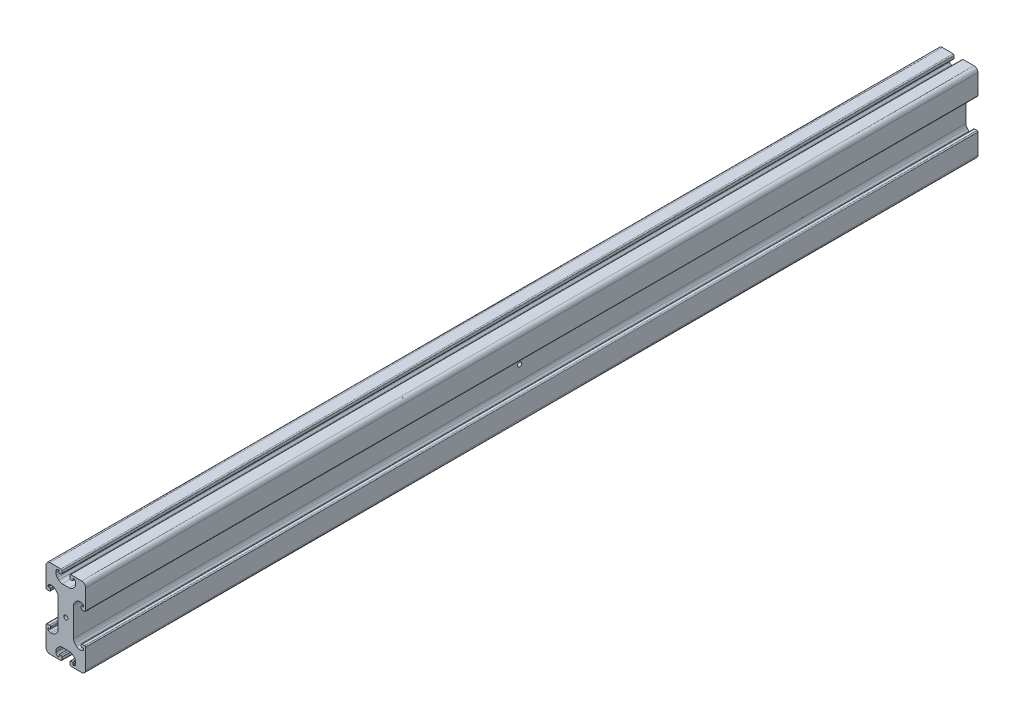
from build123d import *

# Parameters (mm, degrees)
EXTRUDE_3_DEPTH    = 900
HOLE_WIZARD_M5_1_D = 4.2
HOLE_WIZARD_M5_2_D = 4.2


with BuildPart() as part:
    # Model → 凸台-拉伸3 (new body)
    with BuildSketch(Plane.XY):
        with BuildLine():
            Line((3046.183678534, 1527.304832729), (3046.183678534, 1529.804889962))
            add(Edge.make_bspline(
                [(3046.183678534, 1529.804889962), (3046.183678534, 1530.108777492), (3046.477620245, 1530.598884032), (3046.929836169, 1530.80481748), (3047.183606011, 1530.80481748)],
                knots=[0, 0, 0, 0, 0.565195279, 1, 1, 1, 1], degree=3))
            Line((3047.183606011, 1530.80481748), (3048.683735721, 1530.80481748))
            add(Edge.make_bspline(
                [(3048.683735721, 1530.80481748), (3048.814583007, 1530.80481748), (3049.063948712, 1530.68728955), (3049.183699488, 1530.463207638), (3049.183699488, 1530.304853729)],
                knots=[0, 0, 0, 0, 0.482405948, 1, 1, 1, 1], degree=3))
            Line((3049.183699488, 1530.304853729), (3049.183699488, 1528.754894547))
            add(Edge.make_bspline(
                [(3049.183699488, 1528.754894547), (3049.183699488, 1528.621135634), (3049.310613574, 1528.399867559), (3049.514098722, 1528.304760288), (3049.633595356, 1528.304760288)],
                knots=[0, 0, 0, 0, 0.549542039, 1, 1, 1, 1], degree=3))
            Line((3049.633595356, 1528.304760288), (3049.683663262, 1528.304760288))
            add(Edge.make_bspline(
                [(3049.683663262, 1528.304760288), (3050.380891253, 1528.304760288), (3051.623803853, 1528.908542343), (3052.183720448, 1530.04566751), (3052.183720448, 1530.804817427)],
                knots=[0, 0, 0, 0, 0.502793736, 1, 1, 1, 1], degree=3))
            Line((3052.183720448, 1530.804817427), (3052.183720448, 1532.112305099))
            add(Edge.make_bspline(
                [(3052.183720448, 1532.112305099), (3052.183720448, 1532.801572394), (3051.892347197, 1534.083862245), (3051.192575602, 1535.174275324), (3050.719115205, 1535.647813992)],
                knots=[0, 0, 0, 0, 0.510203542, 1, 1, 1, 1], degree=3))
            Line((3050.719115205, 1535.647813992), (3049.276921118, 1537.0902465))
            add(Edge.make_bspline(
                [(3049.276921118, 1537.0902465), (3048.8107636, 1537.556481082), (3047.704647958, 1538.266080891), (3046.441138301, 1538.554851823), (3045.741173633, 1538.554851823)],
                knots=[0, 0, 0, 0, 0.489373028, 1, 1, 1, 1], degree=3))
            Line((3045.741173633, 1538.554851823), (3038.626047963, 1538.554851823))
            add(Edge.make_bspline(
                [(3035.090300479, 1537.0902465), (3035.556457996, 1537.556481082), (3036.662573638, 1538.266080891), (3037.926083295, 1538.554851823), (3038.626047963, 1538.554851823)],
                knots=[0, 0, 0, 0, 0.489373028, 1, 1, 1, 1], degree=3))
            Line((3035.090300479, 1537.0902465), (3033.648106391, 1535.647813992))
            add(Edge.make_bspline(
                [(3032.183501148, 1532.112305099), (3032.183501148, 1532.801572394), (3032.474874399, 1534.083862245), (3033.174645994, 1535.174275324), (3033.648106391, 1535.647813992)],
                knots=[0, 0, 0, 0, 0.510203542, 1, 1, 1, 1], degree=3))
            Line((3032.183501148, 1532.112305099), (3032.183501148, 1530.804817427))
            add(Edge.make_bspline(
                [(3034.683558334, 1528.304760288), (3033.986330343, 1528.304760288), (3032.743417743, 1528.908542343), (3032.183501148, 1530.04566751), (3032.183501148, 1530.804817427)],
                knots=[0, 0, 0, 0, 0.502793736, 1, 1, 1, 1], degree=3))
            Line((3034.683558334, 1528.304760288), (3034.73362624, 1528.304760288))
            add(Edge.make_bspline(
                [(3035.183522108, 1528.754894547), (3035.183522108, 1528.621135634), (3035.056608022, 1528.399867559), (3034.853122874, 1528.304760288), (3034.73362624, 1528.304760288)],
                knots=[0, 0, 0, 0, 0.549542039, 1, 1, 1, 1], degree=3))
            Line((3035.183522108, 1528.754894547), (3035.183522108, 1530.304853729))
            add(Edge.make_bspline(
                [(3035.683485875, 1530.80481748), (3035.552638589, 1530.80481748), (3035.303272884, 1530.68728955), (3035.183522108, 1530.463207638), (3035.183522108, 1530.304853729)],
                knots=[0, 0, 0, 0, 0.482405948, 1, 1, 1, 1], degree=3))
            Line((3035.683485875, 1530.80481748), (3037.183615585, 1530.80481748))
            add(Edge.make_bspline(
                [(3038.183543062, 1529.804889962), (3038.183543062, 1530.108777492), (3037.889601351, 1530.598884032), (3037.437385427, 1530.80481748), (3037.183615585, 1530.80481748)],
                knots=[0, 0, 0, 0, 0.565195279, 1, 1, 1, 1], degree=3))
            Line((3038.183543062, 1529.804889962), (3038.183543062, 1527.304832729))
            add(Edge.make_bspline(
                [(3037.183615506, 1526.304784773), (3037.400016034, 1526.304782453), (3037.898762626, 1526.522558807), (3038.183543062, 1526.949090079), (3038.183543062, 1527.304832729)],
                knots=[0, 0, 0, 0, 0.421033767, 1, 1, 1, 1], degree=3))
            Line((3037.183615506, 1526.304784773), (3026.183459104, 1526.304666828))
            add(Edge.make_bspline(
                [(3026.183459104, 1526.304666828), (3024.834517387, 1526.304681292), (3023.090737297, 1527.365312282), (3022.183510715, 1529.362347968), (3022.183510715, 1530.304971497)],
                knots=[0, 0, 0, 0, 0.5505478, 1, 1, 1, 1], degree=3))
            Line((3022.183510715, 1530.304971497), (3022.183607832, 1550.362581843))
            add(Edge.make_bspline(
                [(3022.183607832, 1550.362581843), (3022.183607832, 1550.699765227), (3022.448675481, 1551.135804662), (3022.948007951, 1551.362509456), (3023.183773703, 1551.362509456)],
                knots=[0, 0, 0, 0, 0.550414522, 1, 1, 1, 1], degree=3))
            Line((3023.183773703, 1551.362509456), (3025.683592516, 1551.362509456))
            add(Edge.make_bspline(
                [(3025.683592516, 1551.362509456), (3026.019499497, 1551.362509456), (3026.456195837, 1551.098991173), (3026.683758449, 1550.599772258), (3026.683758449, 1550.362581982)],
                knots=[0, 0, 0, 0, 0.548463708, 1, 1, 1, 1], degree=3))
            Line((3026.683758449, 1550.362581982), (3026.683758449, 1548.862452264))
            add(Edge.make_bspline(
                [(3026.683758449, 1548.862452264), (3026.683758449, 1548.696304085), (3026.553683171, 1548.477146192), (3026.304004893, 1548.362488499), (3026.183556294, 1548.362488499)],
                knots=[0, 0, 0, 0, 0.543007867, 1, 1, 1, 1], degree=3))
            Line((3026.183556294, 1548.362488499), (3024.633597106, 1548.362488499))
            add(Edge.make_bspline(
                [(3024.633597106, 1548.362488499), (3024.466726182, 1548.362488499), (3024.277869674, 1548.227906514), (3024.183701255, 1548.003776461), (3024.183701255, 1547.912592655)],
                knots=[0, 0, 0, 0, 0.601271686, 1, 1, 1, 1], degree=3))
            Line((3024.183701255, 1547.912592655), (3024.183701255, 1547.86252468))
            add(Edge.make_bspline(
                [(3024.183701255, 1547.86252468), (3024.183701255, 1547.03066165), (3024.833590338, 1545.934626842), (3026.081759899, 1545.362467532), (3026.683758491, 1545.362467532)],
                knots=[0, 0, 0, 0, 0.54350612, 1, 1, 1, 1], degree=3))
            Line((3026.683758491, 1545.362467532), (3027.991245979, 1545.362467532))
            add(Edge.make_bspline(
                [(3027.991245979, 1545.362467532), (3028.669896335, 1545.362467532), (3029.937790713, 1545.635238439), (3031.043033472, 1546.34335127), (3031.526754975, 1546.827072773)],
                knots=[0, 0, 0, 0, 0.495306505, 1, 1, 1, 1], degree=3))
            Line((3031.526754975, 1546.827072773), (3032.969187457, 1548.269505255))
            add(Edge.make_bspline(
                [(3032.969187457, 1548.269505255), (3033.433495699, 1548.733813497), (3034.127479322, 1549.825838212), (3034.433554374, 1551.108475432), (3034.433554374, 1551.805014365)],
                knots=[0, 0, 0, 0, 0.481772339, 1, 1, 1, 1], degree=3))
            Line((3034.433554374, 1551.805014365), (3034.433865315, 1580.805014364))
            add(Edge.make_bspline(
                [(3032.969574214, 1584.340554875), (3033.4338725, 1583.876236677), (3034.127832705, 1582.78419708), (3034.433880252, 1581.501553296), (3034.433865315, 1580.805014364)],
                knots=[0, 0, 0, 0, 0.481772339, 1, 1, 1, 1], degree=3))
            Line((3032.969574214, 1584.340554875), (3031.527172665, 1585.783018289))
            add(Edge.make_bspline(
                [(3027.991695077, 1587.247699345), (3028.670345433, 1587.247684792), (3029.938233961, 1586.974886697), (3031.043461535, 1586.266750164), (3031.527172665, 1585.783018289)],
                knots=[0, 0, 0, 0, 0.495306505, 1, 1, 1, 1], degree=3))
            Line((3027.991695077, 1587.247699345), (3026.684207589, 1587.247727383))
            add(Edge.make_bspline(
                [(3024.184096742, 1584.747723848), (3024.184114581, 1585.579586878), (3024.834027167, 1586.675607749), (3026.082208998, 1587.247740293), (3026.684207589, 1587.247727383)],
                knots=[0, 0, 0, 0, 0.54350612, 1, 1, 1, 1], degree=3))
            Line((3024.184096742, 1584.747723848), (3024.184095668, 1584.697655873))
            add(Edge.make_bspline(
                [(3024.633981872, 1584.247750382), (3024.467110948, 1584.24775396), (3024.278257325, 1584.382339995), (3024.184093713, 1584.606472067), (3024.184095668, 1584.697655873)],
                knots=[0, 0, 0, 0, 0.601271686, 1, 1, 1, 1], degree=3))
            Line((3024.633981872, 1584.247750382), (3026.183941059, 1584.247717144))
            add(Edge.make_bspline(
                [(3026.684132493, 1583.747742652), (3026.684136056, 1583.913890832), (3026.554065477, 1584.133051514), (3026.304389658, 1584.247714561), (3026.183941059, 1584.247717144)],
                knots=[0, 0, 0, 0, 0.543007867, 1, 1, 1, 1], degree=3))
            Line((3026.684132493, 1583.747742652), (3026.684100324, 1582.247612935))
            add(Edge.make_bspline(
                [(3025.683912948, 1581.247706908), (3026.01981993, 1581.247699705), (3026.45652192, 1581.511208624), (3026.684095238, 1582.010422659), (3026.684100324, 1582.247612935)],
                knots=[0, 0, 0, 0, 0.548463708, 1, 1, 1, 1], degree=3))
            Line((3025.683912948, 1581.247706908), (3023.184094136, 1581.247760515))
            add(Edge.make_bspline(
                [(3022.183949708, 1582.247709576), (3022.183942477, 1581.910526192), (3022.449000776, 1581.474481073), (3022.948328384, 1581.247765571), (3023.184094136, 1581.247760515)],
                knots=[0, 0, 0, 0, 0.550414522, 1, 1, 1, 1], degree=3))
            Line((3022.183949708, 1582.247709576), (3022.18428271, 1602.30531992))
            add(Edge.make_bspline(
                [(3026.184316882, 1606.305538812), (3024.835375165, 1606.305553275), (3023.091572331, 1605.244959679), (3022.184302924, 1603.247943449), (3022.18428271, 1602.30531992)],
                knots=[0, 0, 0, 0, 0.5505478, 1, 1, 1, 1], degree=3))
            Line((3026.184316882, 1606.305538812), (3037.184473279, 1606.305184977))
            add(Edge.make_bspline(
                [(3037.184473279, 1606.305184977), (3037.400873807, 1606.305182657), (3037.899615729, 1606.087395608), (3038.184387018, 1605.660858229), (3038.184379389, 1605.305115579)],
                knots=[0, 0, 0, 0, 0.421033767, 1, 1, 1, 1], degree=3))
            Line((3038.184379389, 1605.305115579), (3038.184325777, 1602.805058346))
            add(Edge.make_bspline(
                [(3038.184325777, 1602.805058346), (3038.184319261, 1602.501170817), (3037.89036704, 1602.01107058), (3037.4381467, 1601.80514683), (3037.184376858, 1601.805152271)],
                knots=[0, 0, 0, 0, 0.565195279, 1, 1, 1, 1], degree=3))
            Line((3037.184376858, 1601.805152271), (3035.684247149, 1601.805184441))
            add(Edge.make_bspline(
                [(3035.684247149, 1601.805184441), (3035.553399863, 1601.805187246), (3035.304036679, 1601.922720524), (3035.184290707, 1602.146805004), (3035.184294103, 1602.305158912)],
                knots=[0, 0, 0, 0, 0.482405948, 1, 1, 1, 1], degree=3))
            Line((3035.184294103, 1602.305158912), (3035.184327341, 1603.855118094))
            add(Edge.make_bspline(
                [(3035.184327341, 1603.855118094), (3035.184330209, 1603.988877007), (3035.057420868, 1604.210147804), (3034.85393776, 1604.305259438), (3034.734441126, 1604.305262001)],
                knots=[0, 0, 0, 0, 0.549542039, 1, 1, 1, 1], degree=3))
            Line((3034.734441126, 1604.305262001), (3034.68437322, 1604.305263075))
            add(Edge.make_bspline(
                [(3034.68437322, 1604.305263075), (3033.987145229, 1604.305278026), (3032.744219681, 1603.701522624), (3032.184278702, 1602.564409464), (3032.184262423, 1601.805259548)],
                knots=[0, 0, 0, 0, 0.502793736, 1, 1, 1, 1], degree=3))
            Line((3032.184262423, 1601.805259548), (3032.184234385, 1600.497771876))
            add(Edge.make_bspline(
                [(3032.184234385, 1600.497771876), (3032.184219604, 1599.808504582), (3032.475565357, 1598.526208482), (3033.175313569, 1597.435780397), (3033.648763811, 1596.962231576)],
                knots=[0, 0, 0, 0, 0.510203542, 1, 1, 1, 1], degree=3))
            Line((3033.648763811, 1596.962231576), (3035.090926966, 1595.519768142))
            add(Edge.make_bspline(
                [(3035.090926966, 1595.519768142), (3035.557074486, 1595.053523564), (3036.663174911, 1594.343900035), (3037.926678375, 1594.055102008), (3038.626643043, 1594.055086998)],
                knots=[0, 0, 0, 0, 0.489373028, 1, 1, 1, 1], degree=3))
            Line((3038.626643043, 1594.055086998), (3045.741768711, 1594.05493442))
            add(Edge.make_bspline(
                [(3049.277547602, 1595.519463921), (3048.811380086, 1595.053239335), (3047.705249228, 1594.343663247), (3046.441733379, 1594.05491941), (3045.741768711, 1594.05493442)],
                knots=[0, 0, 0, 0, 0.489373028, 1, 1, 1, 1], degree=3))
            Line((3049.277547602, 1595.519463921), (3050.719772621, 1596.961865502))
            add(Edge.make_bspline(
                [(3052.18445368, 1600.497342987), (3052.184438899, 1599.808075693), (3051.89303815, 1598.52579209), (3051.193243172, 1597.435394017), (3050.719772621, 1596.961865502)],
                knots=[0, 0, 0, 0, 0.510203542, 1, 1, 1, 1], degree=3))
            Line((3052.18445368, 1600.497342987), (3052.184481718, 1601.804830658))
            add(Edge.make_bspline(
                [(3049.684478144, 1604.304941409), (3050.381706135, 1604.304926457), (3051.624605788, 1603.701117749), (3052.184497997, 1602.563980575), (3052.184481718, 1601.804830658)],
                knots=[0, 0, 0, 0, 0.502793736, 1, 1, 1, 1], degree=3))
            Line((3049.684478144, 1604.304941409), (3049.634410238, 1604.304942483))
            add(Edge.make_bspline(
                [(3049.184504718, 1603.854817872), (3049.184507586, 1603.988576784), (3049.311426417, 1604.209842138), (3049.514913604, 1604.304945045), (3049.634410238, 1604.304942483)],
                knots=[0, 0, 0, 0, 0.549542039, 1, 1, 1, 1], degree=3))
            Line((3049.184504718, 1603.854817872), (3049.18447148, 1602.304858689))
            add(Edge.make_bspline(
                [(3048.684496992, 1601.80490566), (3048.815344278, 1601.804902854), (3049.064712503, 1601.922425437), (3049.184468084, 1602.146504781), (3049.18447148, 1602.304858689)],
                knots=[0, 0, 0, 0, 0.482405948, 1, 1, 1, 1], degree=3))
            Line((3048.684496992, 1601.80490566), (3047.184367282, 1601.804937829))
            add(Edge.make_bspline(
                [(3046.184461248, 1602.80488679), (3046.184454732, 1602.50099926), (3046.478385932, 1602.010886417), (3046.93059744, 1601.804943271), (3047.184367282, 1601.804937829)],
                knots=[0, 0, 0, 0, 0.565195279, 1, 1, 1, 1], degree=3))
            Line((3046.184461248, 1602.80488679), (3046.18451486, 1605.304944022))
            add(Edge.make_bspline(
                [(3047.184463861, 1606.304970535), (3046.968063333, 1606.304977496), (3046.469312071, 1606.087211837), (3046.184522489, 1605.660686672), (3046.18451486, 1605.304944022)],
                knots=[0, 0, 0, 0, 0.421033767, 1, 1, 1, 1], degree=3))
            Line((3047.184463861, 1606.304970535), (3058.184620263, 1606.30485259))
            add(Edge.make_bspline(
                [(3058.184620263, 1606.30485259), (3059.533561979, 1606.3048092), (3061.277319324, 1605.244140815), (3062.184503082, 1603.247085676), (3062.184482868, 1602.304462147)],
                knots=[0, 0, 0, 0, 0.5505478, 1, 1, 1, 1], degree=3))
            Line((3062.184482868, 1602.304462147), (3062.184246983, 1582.247184195))
            add(Edge.make_bspline(
                [(3062.184246983, 1582.247184195), (3062.184239753, 1581.910000811), (3061.919162753, 1581.473967061), (3061.419825422, 1581.247272974), (3061.18405967, 1581.24727803)],
                knots=[0, 0, 0, 0, 0.550414522, 1, 1, 1, 1], degree=3))
            Line((3061.18405967, 1581.24727803), (3058.684240858, 1581.247331636))
            add(Edge.make_bspline(
                [(3058.684240858, 1581.247331636), (3058.348333876, 1581.24733884), (3057.911643188, 1581.510866487), (3057.684091281, 1582.010090282), (3057.684096367, 1582.247280559)],
                knots=[0, 0, 0, 0, 0.548463708, 1, 1, 1, 1], degree=3))
            Line((3057.684096367, 1582.247280559), (3057.684128536, 1583.747410276))
            add(Edge.make_bspline(
                [(3057.684128536, 1583.747410276), (3057.684132099, 1583.913558455), (3057.814212077, 1584.132713559), (3058.063892814, 1584.247365897), (3058.184341413, 1584.247363314)],
                knots=[0, 0, 0, 0, 0.543007867, 1, 1, 1, 1], degree=3))
            Line((3058.184341413, 1584.247363314), (3059.7343006, 1584.247330077))
            add(Edge.make_bspline(
                [(3059.7343006, 1584.247330077), (3059.901171524, 1584.247326498), (3060.090030919, 1584.381904433), (3060.184204144, 1584.606032467), (3060.184206099, 1584.697216273)],
                knots=[0, 0, 0, 0, 0.601271686, 1, 1, 1, 1], degree=3))
            Line((3060.184206099, 1584.697216273), (3060.184207173, 1584.747284247))
            add(Edge.make_bspline(
                [(3060.184207173, 1584.747284247), (3060.184225011, 1585.579147277), (3059.534359432, 1586.675196022), (3058.286202141, 1587.247382097), (3057.684203549, 1587.247395007)],
                knots=[0, 0, 0, 0, 0.54350612, 1, 1, 1, 1], degree=3))
            Line((3057.684203549, 1587.247395007), (3056.376716061, 1587.247423045))
            add(Edge.make_bspline(
                [(3056.376716061, 1587.247423045), (3055.698065706, 1587.247437598), (3054.430165479, 1586.97469388), (3053.324907535, 1586.26660475), (3052.841175659, 1585.782893621)],
                knots=[0, 0, 0, 0, 0.495306505, 1, 1, 1, 1], degree=3))
            Line((3052.841175659, 1585.782893621), (3051.398712246, 1584.340492071))
            add(Edge.make_bspline(
                [(3051.398712246, 1584.340492071), (3050.934394047, 1583.876193786), (3050.240387006, 1582.784183953), (3049.934284449, 1581.501553296), (3049.934269512, 1580.805014364)],
                knots=[0, 0, 0, 0, 0.481772339, 1, 1, 1, 1], degree=3))
            Line((3049.934269512, 1580.805014364), (3049.934269512, 1551.805014365))
            add(Edge.make_bspline(
                [(3051.39863643, 1548.269505255), (3050.934328188, 1548.733813497), (3050.240344564, 1549.825838212), (3049.934269512, 1551.108475432), (3049.934269512, 1551.805014365)],
                knots=[0, 0, 0, 0, 0.481772339, 1, 1, 1, 1], degree=3))
            Line((3051.39863643, 1548.269505255), (3052.841068912, 1546.827072773))
            add(Edge.make_bspline(
                [(3056.376577908, 1545.362467532), (3055.697927552, 1545.362467532), (3054.430033174, 1545.635238439), (3053.324790414, 1546.34335127), (3052.841068912, 1546.827072773)],
                knots=[0, 0, 0, 0, 0.495306505, 1, 1, 1, 1], degree=3))
            Line((3056.376577908, 1545.362467532), (3057.684065395, 1545.362467532))
            add(Edge.make_bspline(
                [(3060.184122632, 1547.86252468), (3060.184122632, 1547.03066165), (3059.534233548, 1545.934626842), (3058.286063987, 1545.362467532), (3057.684065395, 1545.362467532)],
                knots=[0, 0, 0, 0, 0.54350612, 1, 1, 1, 1], degree=3))
            Line((3060.184122632, 1547.86252468), (3060.184122632, 1547.912592655))
            add(Edge.make_bspline(
                [(3059.73422678, 1548.362488499), (3059.901097704, 1548.362488499), (3060.089954213, 1548.227906514), (3060.184122632, 1548.003776461), (3060.184122632, 1547.912592655)],
                knots=[0, 0, 0, 0, 0.601271686, 1, 1, 1, 1], degree=3))
            Line((3059.73422678, 1548.362488499), (3058.184267593, 1548.362488499))
            add(Edge.make_bspline(
                [(3057.684065437, 1548.862452264), (3057.684065437, 1548.696304085), (3057.814140715, 1548.477146192), (3058.063818993, 1548.362488499), (3058.184267593, 1548.362488499)],
                knots=[0, 0, 0, 0, 0.543007867, 1, 1, 1, 1], degree=3))
            Line((3057.684065437, 1548.862452264), (3057.684065437, 1550.362581982))
            add(Edge.make_bspline(
                [(3058.684231371, 1551.362509456), (3058.348324389, 1551.362509456), (3057.911628049, 1551.098991173), (3057.684065437, 1550.599772258), (3057.684065437, 1550.362581982)],
                knots=[0, 0, 0, 0, 0.548463708, 1, 1, 1, 1], degree=3))
            Line((3058.684231371, 1551.362509456), (3061.184050183, 1551.362509456))
            add(Edge.make_bspline(
                [(3062.184216054, 1550.362581843), (3062.184216054, 1550.699765227), (3061.919148405, 1551.135804662), (3061.419815936, 1551.362509456), (3061.184050183, 1551.362509456)],
                knots=[0, 0, 0, 0, 0.550414522, 1, 1, 1, 1], degree=3))
            Line((3062.184216054, 1550.362581843), (3062.183710881, 1530.304971497))
            add(Edge.make_bspline(
                [(3058.183762493, 1526.304666828), (3059.532704209, 1526.304681292), (3061.276484299, 1527.365312282), (3062.183710881, 1529.362347968), (3062.183710881, 1530.304971497)],
                knots=[0, 0, 0, 0, 0.5505478, 1, 1, 1, 1], degree=3))
            Line((3058.183762493, 1526.304666828), (3047.18360609, 1526.304784773))
            add(Edge.make_bspline(
                [(3047.18360609, 1526.304784773), (3046.967205562, 1526.304782453), (3046.46845897, 1526.522558807), (3046.183678534, 1526.949090079), (3046.183678534, 1527.304832729)],
                knots=[0, 0, 0, 0, 0.421033767, 1, 1, 1, 1], degree=3))
        make_face()
    extrude(amount=EXTRUDE_3_DEPTH)

    # M5 螺纹孔1 (through all)
    with Locations(Plane.XY.offset(900)):
        with Locations((3042.184205877, 1566.305014364)):
            Hole(HOLE_WIZARD_M5_1_D / 2)

    # M5 螺纹孔2 (through all)
    with Locations(Plane(origin=(3034.416915402, -0.03253535, 0), x_dir=(0, 0, 1), z_dir=(-0.9999999999425182, 1.07221093766048e-05, 0))):
        with Locations((450, 1566.337549805)):
            Hole(HOLE_WIZARD_M5_2_D / 2)


solid = part.part
